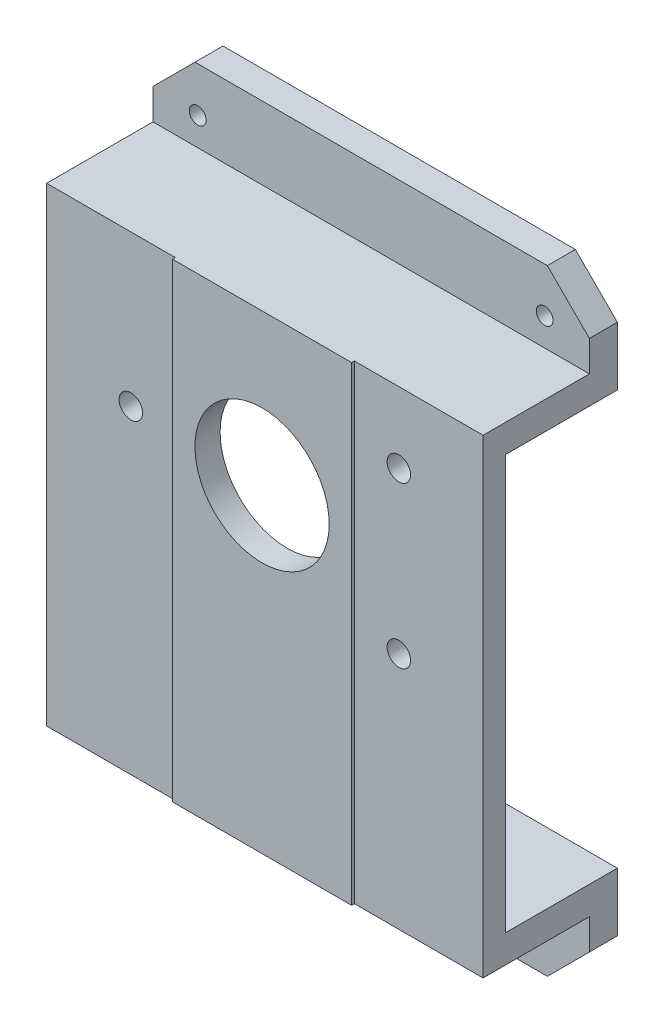
from build123d import *

# Parameters (mm, degrees)
EXTRUDE_1_DEPTH     = 5
EXTRUDE_1_2_DEPTH   = 5
EXTRUDE_2_DEPTH     = 78
CUT_EXTRUDE_1_REACH = 73.568
SKETCH_4_R          = 12
EXTRUDE_START       = 0.5
SKETCH_5_W          = 32
SKETCH_5_H          = 84
SKETCH_5_R          = 12
EXTRUDE_3_DEPTH     = 0.5
CUT_EXTRUDE_2_REACH = 73.568
SKETCH_6_R          = 2.1
CUT_EXTRUDE_3_REACH = 72.187
SKETCH_7_R          = 1.5


with BuildPart() as part:
    # 草图2 → 凸台-拉伸1 (new body)
    with BuildSketch(Plane.XY):
        Polygon((39, 42), (-39, 42), (-39, 47.485281374), (-31.485281374, 55), (31.485281374, 55), (39, 47.485281374), align=None)
    extrude(amount=EXTRUDE_1_DEPTH)



with BuildPart() as body_2:
    # 草图2 → Extrude 1 2 (new body)
    with BuildSketch(Plane.XY):
        Polygon((31.485281374, -55), (-31.485281374, -55), (-39, -47.485281374), (-39, -42), (39, -42), (39, -47.485281374), align=None)
    extrude(amount=EXTRUDE_1_2_DEPTH)


with BuildPart() as part_1:
    add(part.part)

    add(body_2.part)  # 凸台-拉伸2 merges body 2
    # 草图3 → 凸台-拉伸2 (add)
    with BuildSketch(Plane.ZY.offset(39)):
        Polygon((0, 42), (24, 42), (24, -42), (0, -42), (0, -37), (20, -37), (20, 37), (0, 37), align=None)
    extrude(amount=-EXTRUDE_2_DEPTH)

    # 草图4 → 切除-拉伸1 (cut, up to next)
    with BuildSketch(Plane.XY.offset(24), mode=Mode.PRIVATE) as cut_extrude_1_sk1:
        with Locations((0, 15)):
            Circle(SKETCH_4_R)
    cut_extrude_1_tool1 = extrude(cut_extrude_1_sk1.sketch, amount=-CUT_EXTRUDE_1_REACH, mode=Mode.PRIVATE) & part_1.part
    add(cut_extrude_1_tool1.solids().sort_by_distance((0, 15, 24))[0], mode=Mode.SUBTRACT)

    # 草图5 → 凸台-拉伸3 (add)
    with BuildSketch(Plane.XY.offset(24).offset(EXTRUDE_START)):
        Rectangle(SKETCH_5_W, SKETCH_5_H)
        with Locations((0, 15)):
            Circle(SKETCH_5_R, mode=Mode.SUBTRACT)
    extrude(amount=-EXTRUDE_3_DEPTH)

    # 草图6 → 切除-拉伸2 (cut, up to next)
    with BuildSketch(Plane.XY.offset(24), mode=Mode.PRIVATE) as cut_extrude_2_sk1:
        with Locations((-23.95, 15)):
            Circle(SKETCH_6_R)
    cut_extrude_2_tool1 = extrude(cut_extrude_2_sk1.sketch, amount=-CUT_EXTRUDE_2_REACH, mode=Mode.PRIVATE) & part_1.part
    # 草图6 → 切除-拉伸2 (cut, up to next)
    with BuildSketch(Plane.XY.offset(24), mode=Mode.PRIVATE) as cut_extrude_2_sk2:
        with Locations((23.95, 29.35)):
            Circle(SKETCH_6_R)
    cut_extrude_2_tool2 = extrude(cut_extrude_2_sk2.sketch, amount=-CUT_EXTRUDE_2_REACH, mode=Mode.PRIVATE) & part_1.part
    # 草图6 → 切除-拉伸2 (cut, up to next)
    with BuildSketch(Plane.XY.offset(24), mode=Mode.PRIVATE) as cut_extrude_2_sk3:
        with Locations((23.95, 0.65)):
            Circle(SKETCH_6_R)
    cut_extrude_2_tool3 = extrude(cut_extrude_2_sk3.sketch, amount=-CUT_EXTRUDE_2_REACH, mode=Mode.PRIVATE) & part_1.part
    add(cut_extrude_2_tool1.solids().sort_by_distance((-23.95, 15, 24))[0], mode=Mode.SUBTRACT)
    add(cut_extrude_2_tool2.solids().sort_by_distance((23.95, 29.35, 24))[0], mode=Mode.SUBTRACT)
    add(cut_extrude_2_tool3.solids().sort_by_distance((23.95, 0.65, 24))[0], mode=Mode.SUBTRACT)

    # 草图7 → 切除-拉伸3 (cut, up to next)
    with BuildSketch(Plane.XY.offset(5), mode=Mode.PRIVATE) as cut_extrude_3_sk1:
        with Locations((-31, 47)):
            Circle(SKETCH_7_R)
    cut_extrude_3_tool1 = extrude(cut_extrude_3_sk1.sketch, amount=-CUT_EXTRUDE_3_REACH, mode=Mode.PRIVATE) & part_1.part
    # 草图7 → 切除-拉伸3 (cut, up to next)
    with BuildSketch(Plane.XY.offset(5), mode=Mode.PRIVATE) as cut_extrude_3_sk2:
        with Locations((31, 47)):
            Circle(SKETCH_7_R)
    cut_extrude_3_tool2 = extrude(cut_extrude_3_sk2.sketch, amount=-CUT_EXTRUDE_3_REACH, mode=Mode.PRIVATE) & part_1.part
    # 草图7 → 切除-拉伸3 (cut, up to next)
    with BuildSketch(Plane.XY.offset(5), mode=Mode.PRIVATE) as cut_extrude_3_sk3:
        with Locations((31, -47)):
            Circle(SKETCH_7_R)
    cut_extrude_3_tool3 = extrude(cut_extrude_3_sk3.sketch, amount=-CUT_EXTRUDE_3_REACH, mode=Mode.PRIVATE) & part_1.part
    # 草图7 → 切除-拉伸3 (cut, up to next)
    with BuildSketch(Plane.XY.offset(5), mode=Mode.PRIVATE) as cut_extrude_3_sk4:
        with Locations((-31, -47)):
            Circle(SKETCH_7_R)
    cut_extrude_3_tool4 = extrude(cut_extrude_3_sk4.sketch, amount=-CUT_EXTRUDE_3_REACH, mode=Mode.PRIVATE) & part_1.part
    add(cut_extrude_3_tool1.solids().sort_by_distance((-31, 47, 5))[0], mode=Mode.SUBTRACT)
    add(cut_extrude_3_tool2.solids().sort_by_distance((31, 47, 5))[0], mode=Mode.SUBTRACT)
    add(cut_extrude_3_tool3.solids().sort_by_distance((31, -47, 5))[0], mode=Mode.SUBTRACT)
    add(cut_extrude_3_tool4.solids().sort_by_distance((-31, -47, 5))[0], mode=Mode.SUBTRACT)


solid = part_1.part
